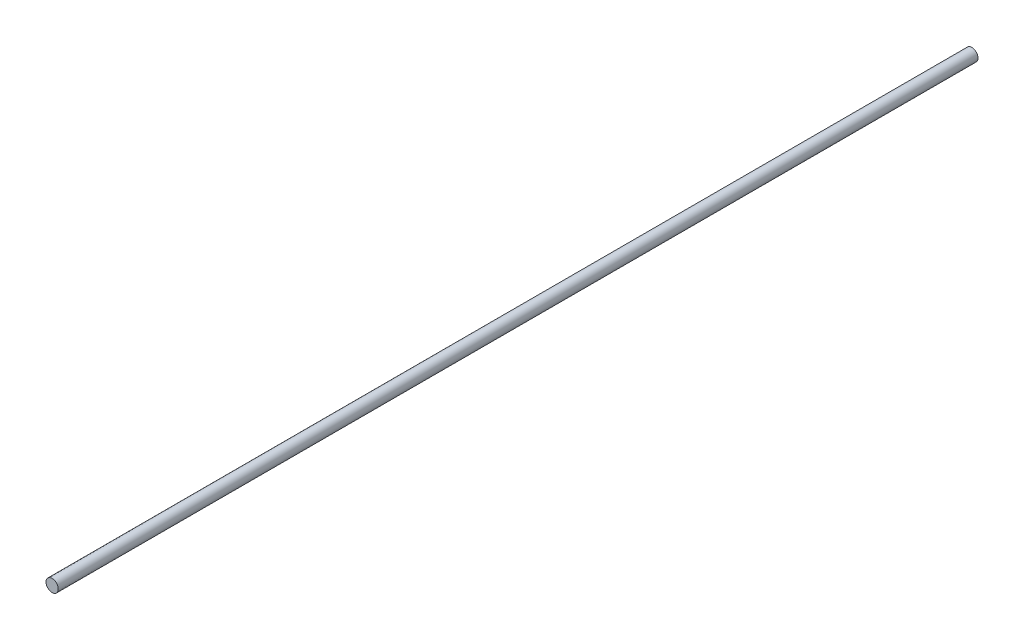
from build123d import *

# Parameters (mm, degrees)
SKETCH_1_R      = 4
EXTRUDE_1_DEPTH = 300


with BuildPart() as part:
    # 草图1 → 凸台-拉伸1 (new, symmetric)
    with BuildSketch(Plane.XY):
        Circle(SKETCH_1_R)
    extrude(amount=EXTRUDE_1_DEPTH, both=True)


solid = part.part
